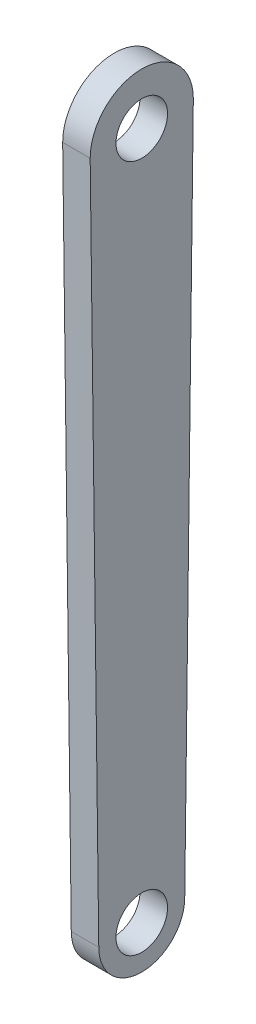
from build123d import *

# Parameters (mm, degrees)
EXTRUDE_1_DEPTH     = 8
SKETCH_2_R          = 7.5
CUT_EXTRUDE_1_DEPTH = 10


with BuildPart() as part:
    # 草图1 → 凸台-拉伸1 (new body)
    with BuildSketch(Plane(origin=(0, 0, 0), x_dir=(0, 0, -1), z_dir=(1, 0, 0))):
        with BuildLine():
            Line((-15, 0), (-12.5, -200))
            ThreePointArc((-12.5, -200), (0, -212.5), (12.5, -200))
            Line((12.5, -200), (15, 0))
            ThreePointArc((15, 0), (0, 15), (-15, 0))
        make_face()
    extrude(amount=EXTRUDE_1_DEPTH)

    # 草图2 → 切除-拉伸1 (cut)
    with BuildSketch(Plane(origin=(8, 0, 0), x_dir=(0, 0, -1), z_dir=(1, 0, 0))):
        Circle(SKETCH_2_R)
        with Locations((0, -200)):
            Circle(SKETCH_2_R)
    extrude(amount=-CUT_EXTRUDE_1_DEPTH, mode=Mode.SUBTRACT)


solid = part.part
